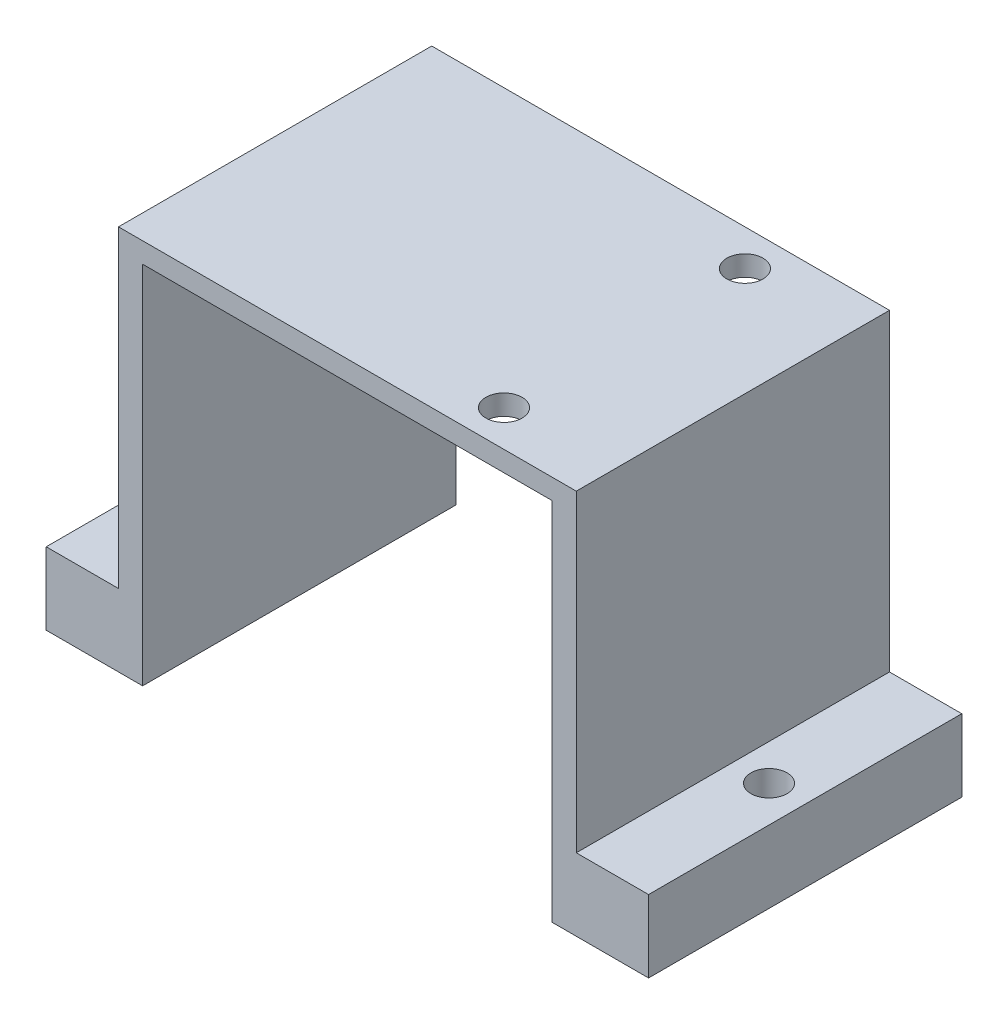
from build123d import *

# Parameters (mm, degrees)
BOSS_EXTRUDE1_DEPTH = 26
SKETCH2_R           = 1.5
CUT_EXTRUDE1_DEPTH  = 48.117375685
SKETCH3_R           = 1.5
CUT_EXTRUDE2_DEPTH  = 45.463468151
CUT_EXTRUDE3_DEPTH  = 10


with BuildPart() as part:
    # Sketch1 → Boss-Extrude1 (new body)
    with BuildSketch(Plane.XY):
        Polygon((-25, -16), (-17, -16), (-17, 14.315789474), (17, 14.315789474), (17, -16), (25, -16), (25, -10), (19, -10), (19, 16), (-19, 16), (-19, -10), (-25, -10), align=None)
    extrude(amount=BOSS_EXTRUDE1_DEPTH)

    # Sketch2 → Cut-Extrude1 (cut, through all)
    with BuildSketch(Plane.XZ.offset(-14.315789474)):
        with Locations((10, 23)):
            Circle(SKETCH2_R)
        with Locations((10, 3)):
            Circle(SKETCH2_R)
    extrude(amount=-CUT_EXTRUDE1_DEPTH, mode=Mode.SUBTRACT)

    # Sketch3 → Cut-Extrude2 (cut, through all)
    with BuildSketch(Plane(origin=(0, -10, 0), x_dir=(1, 0, 0), z_dir=(0, 1, 0))):
        with Locations((22, -13)):
            Circle(SKETCH3_R)
        with Locations((-22, -13)):
            Circle(SKETCH3_R)
    extrude(amount=-CUT_EXTRUDE2_DEPTH, mode=Mode.SUBTRACT)

    # Sketch4 → Cut-Extrude3 (cut)
    with BuildSketch(Plane.ZY.offset(19)):
        with BuildLine():
            Line((18, 14), (8, 14))
            ThreePointArc((8, 14), (5, 11), (8, 8))
            Line((8, 8), (18, 8))
            ThreePointArc((18, 8), (21, 11), (18, 14))
        make_face()
    extrude(amount=-CUT_EXTRUDE3_DEPTH, mode=Mode.SUBTRACT)


solid = part.part
